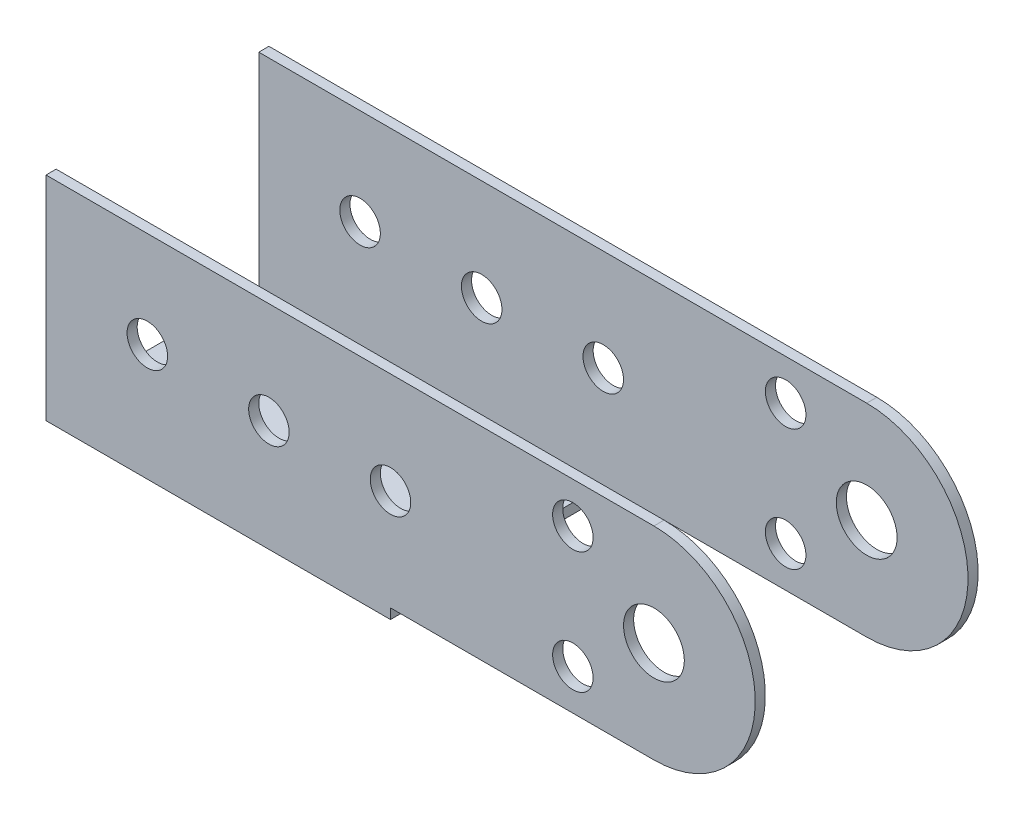
from build123d import *

# Parameters (mm, degrees)
SKETCH_2_R      = 1.5
SKETCH_2_R_2    = 1
EXTRUDE_1_DEPTH = 0.5
SKETCH_1_R      = 1.5
SKETCH_1_R_2    = 1
EXTRUDE_2_DEPTH = 0.5
SKETCH_4_W      = 17
SKETCH_4_H      = 11
EXTRUDE_4_DEPTH = 0.5


with BuildPart() as part:
    # 草图2 → 凸台-拉伸1 (new body)
    with BuildSketch(Plane.XY.offset(10)):
        with BuildLine():
            Line((15, 5), (-15, 5))
            Line((-15, 5), (-15, -5))
            Line((-15, -5), (15, -5))
            ThreePointArc((15, -5), (20, 0), (15, 5))
        make_face()
        with Locations((15, 0)):
            Circle(SKETCH_2_R, mode=Mode.SUBTRACT)
        with Locations((11, -3)):
            Circle(SKETCH_2_R_2, mode=Mode.SUBTRACT)
        with Locations((11, 3)):
            Circle(SKETCH_2_R_2, mode=Mode.SUBTRACT)
        with Locations((2, 0)):
            Circle(SKETCH_2_R_2, mode=Mode.SUBTRACT)
        with Locations((-4, 0)):
            Circle(SKETCH_2_R_2, mode=Mode.SUBTRACT)
        with Locations((-10, 0.253438211)):
            Circle(SKETCH_2_R_2, mode=Mode.SUBTRACT)
    extrude(amount=EXTRUDE_1_DEPTH)



with BuildPart() as body_2:
    # 草图1 → 凸台-拉伸2 (new body)
    with BuildSketch(Plane.XY):
        with BuildLine():
            Line((-15, 5), (15, 5))
            ThreePointArc((15, 5), (20, 0), (15, -5))
            Line((15, -5), (-15, -5))
            Line((-15, -5), (-15, 5))
        make_face()
        with Locations((15, 0)):
            Circle(SKETCH_1_R, mode=Mode.SUBTRACT)
        with Locations((-10, 0.253438211)):
            Circle(SKETCH_1_R_2, mode=Mode.SUBTRACT)
        with Locations((-4, 0)):
            Circle(SKETCH_1_R_2, mode=Mode.SUBTRACT)
        with Locations((2, 0)):
            Circle(SKETCH_1_R_2, mode=Mode.SUBTRACT)
        with Locations((11, 3)):
            Circle(SKETCH_1_R_2, mode=Mode.SUBTRACT)
        with Locations((11, -3)):
            Circle(SKETCH_1_R_2, mode=Mode.SUBTRACT)
    extrude(amount=-EXTRUDE_2_DEPTH)


with BuildPart() as part_1:
    add(part.part)

    add(body_2.part)  # 凸台-拉伸4 merges body 2
    # 草图4 → 凸台-拉伸4 (add)
    with BuildSketch(Plane(origin=(0, -5, 0), x_dir=(1, 0, 0), z_dir=(0, 1, 0))):
        with Locations((-6.5, -5)):
            Rectangle(SKETCH_4_W, SKETCH_4_H)
    extrude(amount=-EXTRUDE_4_DEPTH)


solid = part_1.part
